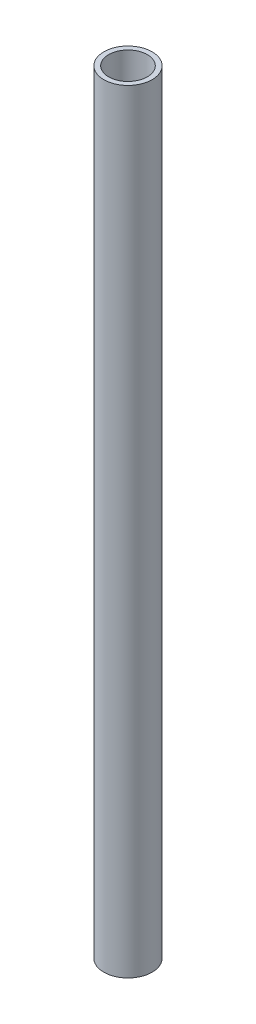
from build123d import *

# Parameters (mm, degrees)
SKETCH1_R           = 3.175
SKETCH1_R_2         = 2.54
BOSS_EXTRUDE1_DEPTH = 101.6


with BuildPart() as part:
    # Sketch1 → Boss-Extrude1 (new body)
    with BuildSketch(Plane(origin=(0, 0, 0), x_dir=(1, 0, 0), z_dir=(0, 1, 0))):
        Circle(SKETCH1_R)
        Circle(SKETCH1_R_2, mode=Mode.SUBTRACT)
    extrude(amount=BOSS_EXTRUDE1_DEPTH)


solid = part.part
